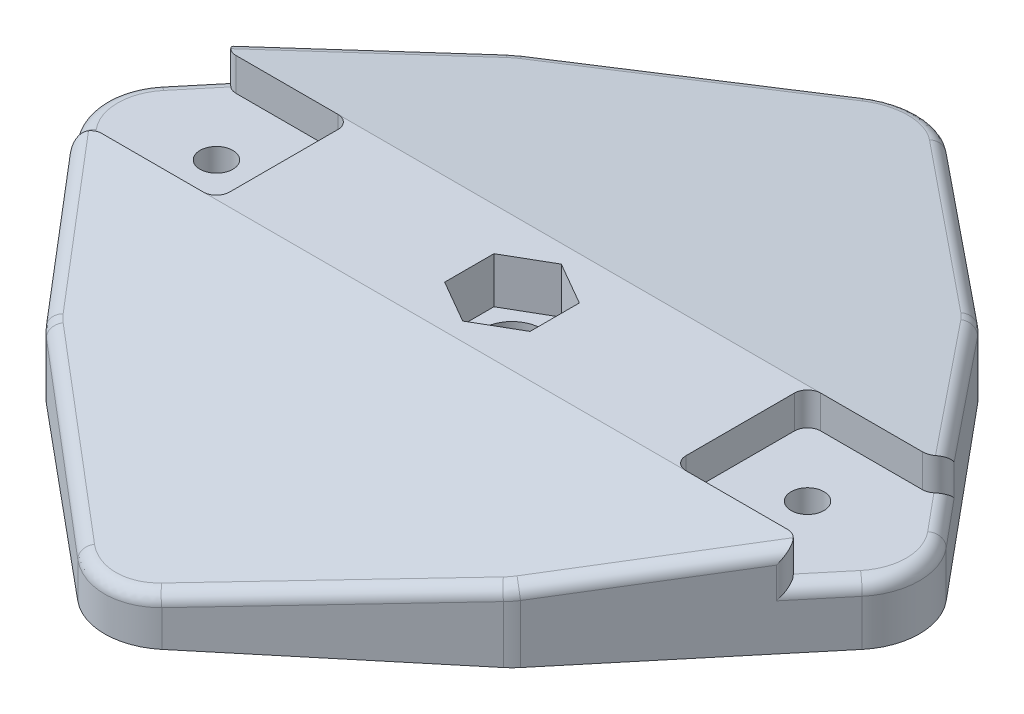
from build123d import *

# Parameters (mm, degrees)
ESQUISSE1_R                  = 4.5
ESQUISSE1_R_2                = 2.4999999999999947
ESQUISSE1_R_3                = 2.500000000000002
BOSS_EXTRU_1_DEPTH           = 9
ESQUISSE2_OUTSIDE_W          = 172.788
ESQUISSE2_OUTSIDE_H          = 199.11
ENL_V_MAT_EXTRU_1_DEPTH      = 103.10046824457444
CONG_1_R                     = 10
ESQUISSE3_R                  = 4.5
BOSS_EXTRU_2_DEPTH           = 5
ENL_V_MAT_EXTRU_2_DEPTH      = 7
ESQUISSE5_R                  = 6.000000000000003
ENL_V_MAT_EXTRU_3_DEPTH      = 4
ENL_V_MAT_EXTRU_5_DEPTH      = 116.79687329576521
ENL_V_MAT_EXTRU_5_DEPTH_BACK = 116.79687329576521
CONG_2_R                     = 2


with BuildPart() as part:
    # Esquisse1 → Boss.-Extru.1 (new body)
    with BuildSketch(Plane(origin=(0, 0, 0), x_dir=(1, 0, 0), z_dir=(0, 1, 0))):
        Polygon((-65.03288181544035, -1.1e-16), (1.14e-14, -78.19354128404926), (65.03288181544036, -2.2e-16), (-1.33e-15, 78.19354128404929), align=None)
        with Locations(Location((0, 0, 0), (0, 0, 270))):
            Circle(ESQUISSE1_R, mode=Mode.SUBTRACT)
        with Locations(Location((-45, 0, 0), (0, 0, 270))):
            Circle(ESQUISSE1_R_2, mode=Mode.SUBTRACT)
        with Locations(Location((45, 0, 0), (0, 0, 270))):
            Circle(ESQUISSE1_R_3, mode=Mode.SUBTRACT)
    extrude(amount=BOSS_EXTRU_1_DEPTH)

    # Esquisse2 outside → Enlèv. mat.-Extru.1 (cut, through all)
    with BuildSketch(Plane(origin=(0, 9, 0), x_dir=(1, 0, 0), z_dir=(0, 1, 0))):
        Rectangle(ESQUISSE2_OUTSIDE_W, ESQUISSE2_OUTSIDE_H)
        Polygon((3.05e-15, 65.03288181544038), (-78.1935412840493, 1.183e-14), (-1.388e-14, -65.03288181544033), (78.1935412840493, 1.69e-14), align=None, mode=Mode.SUBTRACT)
    extrude(amount=-ENL_V_MAT_EXTRU_1_DEPTH, mode=Mode.SUBTRACT)

    # Congé1
    cong_1_edges = [part.edges().sort_by_distance(p)[0] for p in [
        (35.50428209412193, 4.5, -35.50428209412183),
        (35.504282094121805, 4.5, 35.50428209412193),
        (-35.50428209412127, 4.5, 35.50428209412245),
        (-35.504282094121926, 4.5, -35.504282094121834),
        (3.05e-15, 4.5, -65.03288181544038),
        (-1.388e-14, 4.5, 65.03288181544033),
        (65.03288181544036, 4.5, 2.2e-16),
        (-65.03288181544035, 4.5, 1.1e-16),
    ]]
    fillet(cong_1_edges, radius=CONG_1_R)

    # Esquisse3 → Boss.-Extru.2 (add)
    with BuildSketch(Plane(origin=(0, 9, 0), x_dir=(1, 0, 0), z_dir=(0, 1, 0))):
        with BuildLine():
            Line((-56.50804680142313, 10.250000000000002), (-34.74999999999999, 10.25))
            Line((-34.74999999999999, 10.25), (-34.74999999999999, -10.25))
            Line((-34.74999999999999, -10.25), (-56.50804680142313, -10.25))
            Line((-56.50804680142313, -10.25), (-36.091843996032054, -34.79781569510337))
            ThreePointArc((-36.091843996032054, -34.79781569510337), (-35.47449348716292, -35.47449348716301), (-34.79781569510328, -36.091843996032146))
            Line((-34.79781569510328, -36.091843996032146), (-6.394390019805823, -59.71472377308688))
            ThreePointArc((-6.394390019805823, -59.71472377308688), (-2.16e-15, -62.026305452352254), (6.3943900198058135, -59.71472377308687))
            Line((6.3943900198058135, -59.71472377308687), (34.797815695103374, -36.09184399603205))
            ThreePointArc((34.797815695103374, -36.09184399603205), (35.47449348716302, -35.47449348716292), (36.09184399603216, -34.79781569510327))
            Line((36.09184399603216, -34.79781569510327), (56.50804680142313, -10.25))
            Line((56.50804680142313, -10.25), (34.74999999999999, -10.25))
            Line((34.74999999999999, -10.25), (34.74999999999999, 10.25))
            Line((34.74999999999999, 10.25), (56.50804680142313, 10.250000000000002))
            Line((56.50804680142313, 10.250000000000002), (36.09184399603206, 34.797815695103395))
            ThreePointArc((36.09184399603206, 34.797815695103395), (35.47449348716294, 35.47449348716303), (34.7978156951033, 36.09184399603216))
            Line((34.7978156951033, 36.09184399603216), (6.394390019805837, 59.71472377308691))
            ThreePointArc((6.394390019805837, 59.71472377308691), (5.05e-15, 62.02630545235231), (-6.394390019805832, 59.71472377308692))
            Line((-6.394390019805832, 59.71472377308692), (-34.797815695103225, 36.09184399603222))
            ThreePointArc((-34.797815695103225, 36.09184399603222), (-35.47449348716287, 35.47449348716309), (-36.091843996032004, 34.79781569510345))
            Line((-36.091843996032004, 34.79781569510345), (-56.50804680142313, 10.250000000000002))
        make_face()
        with Locations(Location((0, 0, 0), (0, 0, 270))):
            Circle(ESQUISSE3_R, mode=Mode.SUBTRACT)
    extrude(amount=BOSS_EXTRU_2_DEPTH)

    # Esquisse4 → Enlèv. mat.-Extru.2 (cut)
    with BuildSketch(Plane(origin=(0, 13.999999999999998, 0), x_dir=(1, 0, 0), z_dir=(0, 1, 0))):
        Polygon((6.500000000000003, 3.7527767497325644), (3.51e-15, 7.5055534994651305), (-6.499999999999996, 3.752776749732566), (-6.499999999999996, -3.752776749732568), (7.1e-15, -7.505553499465138), (6.499999999999999, -3.752776749732574), align=None)
    extrude(amount=-ENL_V_MAT_EXTRU_2_DEPTH, mode=Mode.SUBTRACT)

    # Esquisse5 → Enlèv. mat.-Extru.3 (cut)
    with BuildSketch(Plane.XZ):
        with Locations(Location((-45, 0, 0), (0, 0, 270))):
            Circle(ESQUISSE5_R)
        with Locations(Location((45, 0, 0), (0, 0, 270))):
            Circle(ESQUISSE5_R)
    extrude(amount=-ENL_V_MAT_EXTRU_3_DEPTH, mode=Mode.SUBTRACT)

    # Esquisse6 → Enlèv. mat.-Extru.5 (cut, two sides: drawn at the far end of the back side and taken through both)
    with BuildSketch(Plane(origin=(34.74999999999999, 0, 0), x_dir=(0, 0, -1), z_dir=(1, 0, 0)).offset(-ENL_V_MAT_EXTRU_5_DEPTH_BACK)):
        Polygon((-62.02630545235226, 6.999999999999998), (-10.25, 13.999999999999998), (10.25, 13.999999999999998), (62.02630545235227, 7.000000000000001), (62.026305452352254, 36.4147856499244), (-62.026305452352254, 36.4147856499244), align=None)
    extrude(amount=ENL_V_MAT_EXTRU_5_DEPTH + ENL_V_MAT_EXTRU_5_DEPTH_BACK, mode=Mode.SUBTRACT)

    # Congé2
    cong_2_edges = [part.edges().sort_by_distance(p)[0] for p in [
        (58.11138528725502, 9, 8.322195009902927),
        (-58.11138528725501, 9, -8.322195009902927),
        (56.50804680142313, 11.5, 10.25),
        (34.74999999999999, 11.5, 10.25),
        (34.74999999999999, 11.5, -10.25),
        (56.50804680142313, 11.5, -10.250000000000002),
        (-56.50804680142313, 11.5, -10.250000000000002),
        (-34.74999999999999, 11.5, -10.25),
        (-34.74999999999999, 11.5, 10.25),
        (-56.50804680142313, 11.5, 10.25),
        (-46.299945398727594, 12.340604757673788, -22.523907847551726),
        (46.2999453987276, 12.340604757673791, -22.523907847551705),
        (20.596102857454603, 8.909389828239629, -47.90328388455951),
        (3.4028602353834634, 7.0806828820281655, -61.429525231685666),
        (35.47476156274495, 10.589760967545045, -35.47422540141744),
        (-46.299945398727345, 12.340604757673752, 22.523907847551982),
        (46.29994539872759, 12.340604757673788, 22.523907847551698),
        (3.4028602353834314, 7.080682882028164, 61.429525231685645),
        (20.596102857454596, 8.909389828239629, 47.903283884559464),
        (35.4747615627448, 10.589760967545022, 35.47422540141758),
        (-20.596102857454614, 8.909389828239625, -47.903283884559514),
        (-35.47476156274494, 10.589760967545041, -35.47422540141746),
        (-35.47476156274429, 10.589760967544956, 35.474225401418074),
        (-20.59610285745456, 8.909389828239624, 47.90328388455953),
        (58.11138528725502, 9, -8.322195009902925),
        (-58.111385287255004, 9, 8.322195009902918),
        (-62.02630545235229, 9, 8.38e-15),
        (62.02630545235229, 9, -4.51e-15),
    ]]
    fillet(cong_2_edges, radius=CONG_2_R)


solid = part.part
